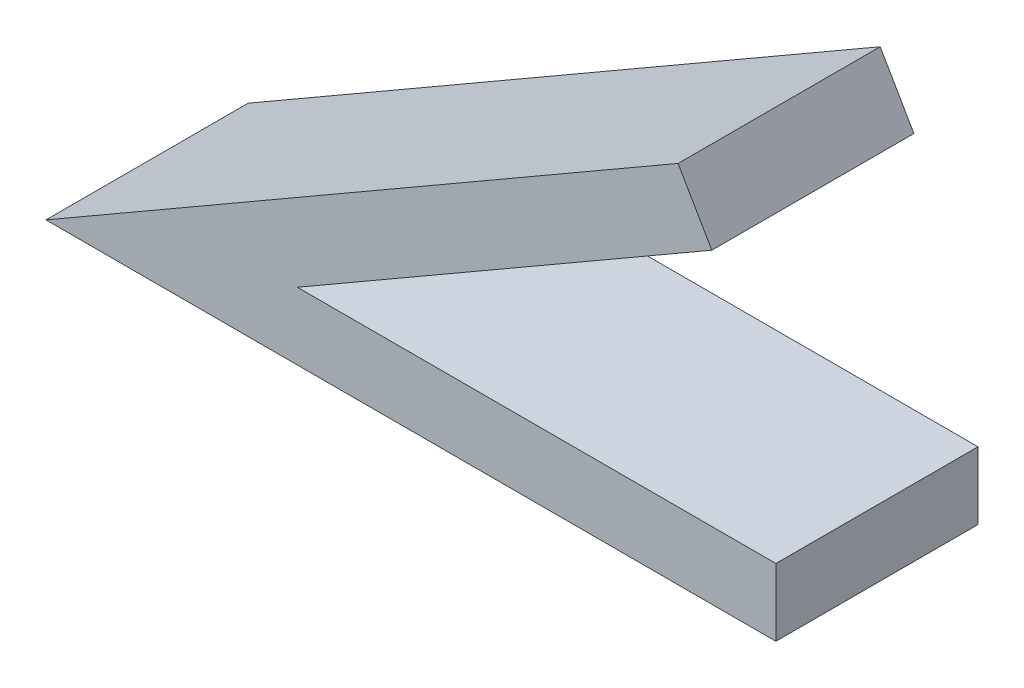
from build123d import *

# Parameters (mm, degrees)
EXTRUDE_1_DEPTH = 18


with BuildPart() as part:
    # 草图1 → 凸台-拉伸1 (new body)
    with BuildSketch(Plane.XY):
        Polygon((0, 0), (-65, 0), (-8.708348754, 32.5), (-5.708348754, 27.303847577), (-42.607695155, 6), (0, 6), align=None)
    extrude(amount=EXTRUDE_1_DEPTH)


solid = part.part
